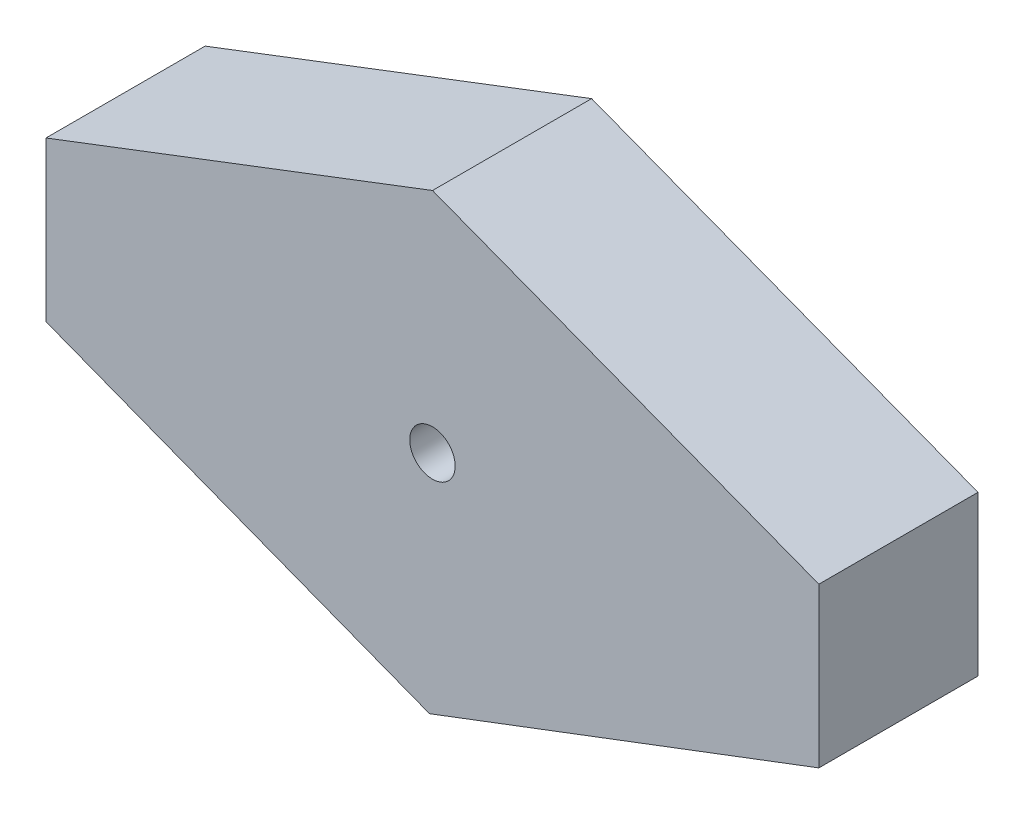
from build123d import *

# Parameters (mm, degrees)
SKIZZE1_R                       = 1
AUFSATZ_LINEAR_AUSTRAGEN1_DEPTH = 7


with BuildPart() as part:
    # Skizze1 → Aufsatz-Linear austragen1 (new body)
    with BuildSketch(Plane.XY):
        Polygon((-0.129330788, -9.999163642), (-17, -3.5), (-17, 3.5), (0.003278501, 10.000396722), (17, 3.5), (17, -3.5), align=None)
        Circle(SKIZZE1_R, mode=Mode.SUBTRACT)
    extrude(amount=AUFSATZ_LINEAR_AUSTRAGEN1_DEPTH)


solid = part.part
